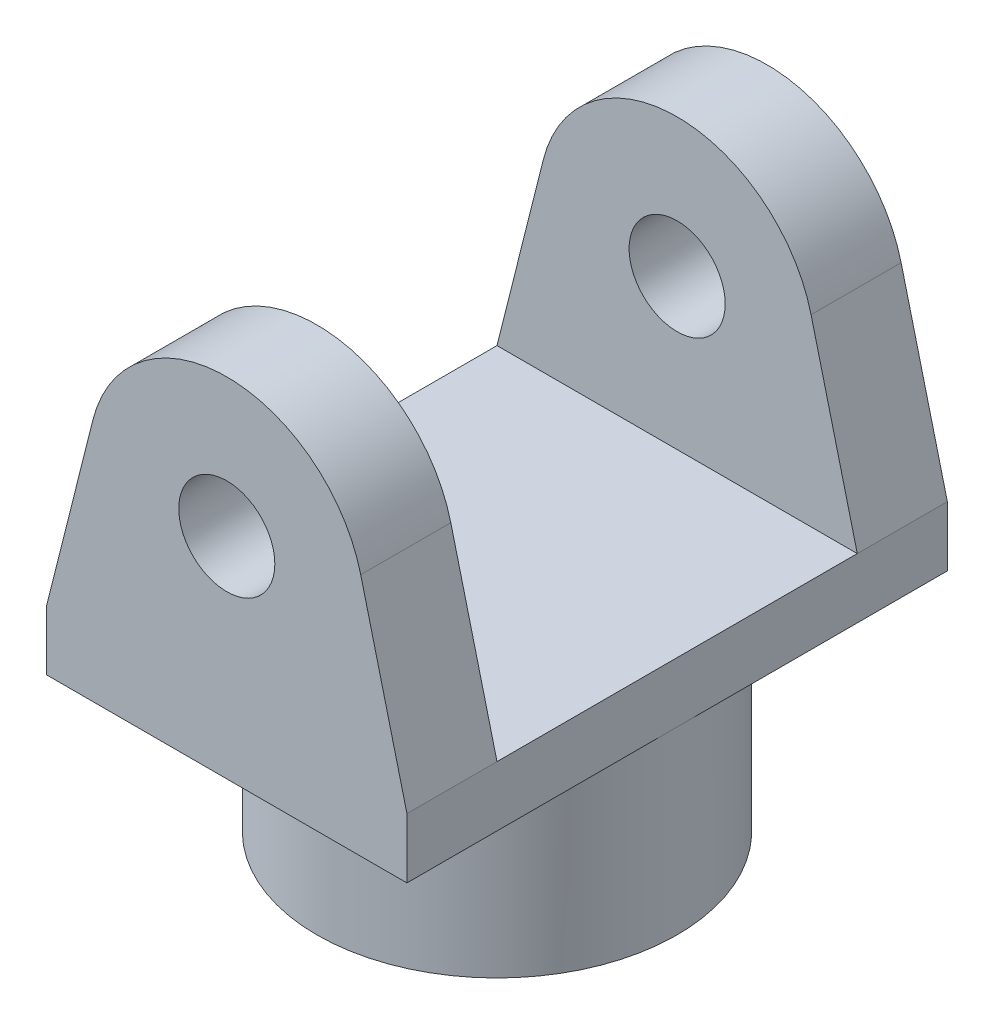
from build123d import *

# Parameters (mm, degrees)
SKETCH1_W           = 60
SKETCH1_H           = 90
BOSS_EXTRUDE1_DEPTH = 10
BOSS_EXTRUDE2_DEPTH = 30
SKETCH3_R           = 8
BOSS_EXTRUDE3_DEPTH = 15


with BuildPart() as part:
    # Sketch1 → Boss-Extrude1 (new body)
    with BuildSketch(Plane(origin=(0, 0, 0), x_dir=(1, 0, 0), z_dir=(0, 1, 0))):
        Rectangle(SKETCH1_W, SKETCH1_H)
    extrude(amount=BOSS_EXTRUDE1_DEPTH)

    # Sketch1<3> → Boss-Extrude2 (add)
    with BuildSketch(Plane(origin=(0, 0, 0), x_dir=(1, 0, 0), z_dir=(0, 1, 0))):
        with BuildLine():
            ThreePointArc((-30, -1.1e-08), (5e-09, -30), (30, 0))
            ThreePointArc((30, 0), (-5e-09, 30), (-30, -1.1e-08))
        make_face()
        with BuildLine():
            Line((5, 20.142135624), (5, 14.142135624))
            ThreePointArc((5, 14.142135624), (12.247448714, 8.660254038), (15, 0))
            ThreePointArc((15, 0), (-8.660254038, -12.247448714), (-5, 14.142135624))
            Line((-5, 14.142135624), (-5, 20.142135624))
            Line((-5, 20.142135624), (5, 20.142135624))
        make_face(mode=Mode.SUBTRACT)
    extrude(amount=-BOSS_EXTRUDE2_DEPTH)

    # Sketch3 → Boss-Extrude3 (add)
    with BuildSketch(Plane.XY.offset(45)):
        with BuildLine():
            Line((-22.306028796, 40.607234555), (-30, 10))
            Line((-30, 10), (30, 10))
            Line((30, 10), (22.306028796, 40.607234555))
            ThreePointArc((22.306028796, 40.607234555), (0, 58), (-22.306028796, 40.607234555))
        make_face()
        with Locations((0, 35)):
            Circle(SKETCH3_R, mode=Mode.SUBTRACT)
    boss_extrude3 = extrude(amount=-BOSS_EXTRUDE3_DEPTH)

    # Mirror1: Boss-Extrude3 across plane
    add(boss_extrude3.mirror(Plane.XY))


solid = part.part
